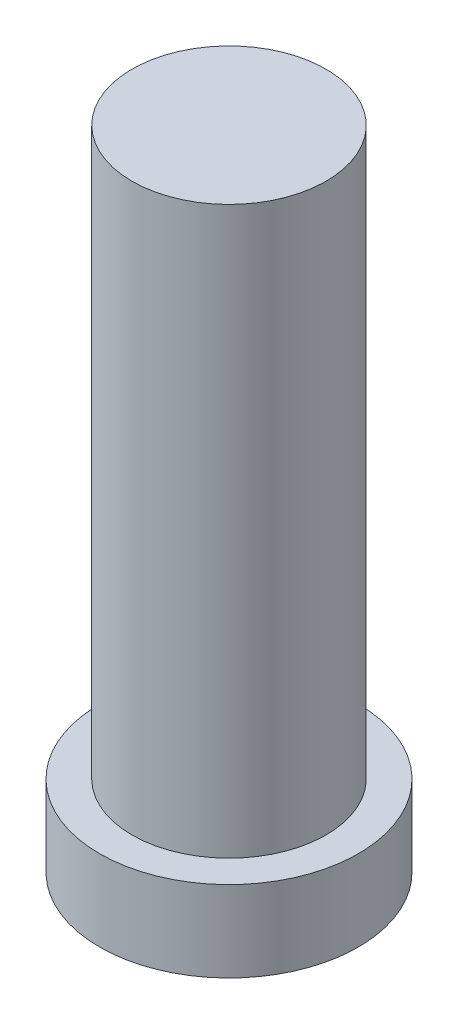
from build123d import *

# Parameters (mm, degrees)
SKETCH_1_R      = 80
EXTRUDE_1_DEPTH = 50
SKETCH_2_R      = 60
EXTRUDE_2_DEPTH = 350


with BuildPart() as part:
    # 草图1 → 凸台-拉伸1 (new body)
    with BuildSketch(Plane(origin=(0, 0, 0), x_dir=(1, 0, 0), z_dir=(0, 1, 0))):
        with Locations(Location((0, 0, 0), (0, 0, 270))):
            Circle(SKETCH_1_R)
    extrude(amount=-EXTRUDE_1_DEPTH)

    # 草图2 → 凸台-拉伸2 (add)
    with BuildSketch(Plane(origin=(0, 0, 0), x_dir=(1, 0, 0), z_dir=(0, 1, 0))):
        with Locations(Location((0, 0, 0), (0, 0, 270))):
            Circle(SKETCH_2_R)
    extrude(amount=EXTRUDE_2_DEPTH)


solid = part.part
